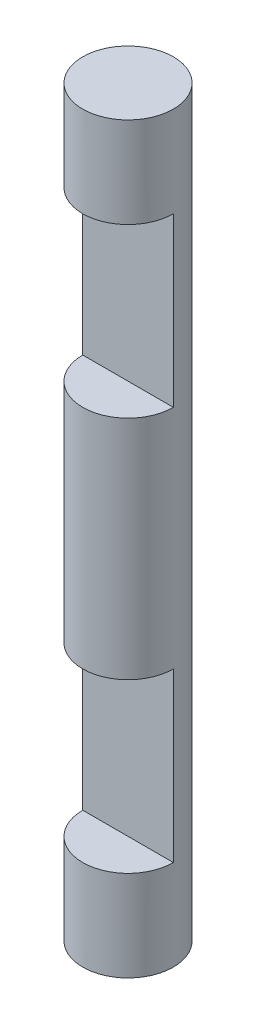
from build123d import *

# Parameters (mm, degrees)
SKETCH1_R           = 13
BOSS_EXTRUDE1_DEPTH = 1
SKETCH16_R          = 13
BOSS_EXTRUDE3_DEPTH = 1
SKETCH19_R          = 1
BOSS_EXTRUDE4_DEPTH = 29.8
SKETCH18_W          = 22
SKETCH18_H          = 22
CUT_EXTRUDE6_DEPTH  = 3.7
SKETCH21_W          = 22
SKETCH21_H          = 22
CUT_EXTRUDE7_DEPTH  = 3.7
SKETCH22_R          = 11
CUT_EXTRUDE8_DEPTH  = 3.7
SKETCH23_R          = 11
CUT_EXTRUDE9_DEPTH  = 3.7
SKETCH24_R          = 19.921792127
CUT_EXTRUDE10_DEPTH = 1
SKETCH25_R          = 36.182885583
CUT_EXTRUDE11_DEPTH = 1
BOSS_EXTRUDE5_START = 2
BOSS_EXTRUDE5_DEPTH = 2
SKETCH27_R          = 1
BOSS_EXTRUDE6_DEPTH = 2
SKETCH28_R          = 9.676669919
CUT_EXTRUDE12_DEPTH = 17.4


with BuildPart() as part:
    # Sketch1 → Boss-Extrude1 (new body)
    with BuildSketch(Plane(origin=(0, 0, 0), x_dir=(1, 0, 0), z_dir=(0, 1, 0))):
        with Locations(Location((0, 0, 0), (0, 0, 270))):
            Circle(SKETCH1_R)
    extrude(amount=BOSS_EXTRUDE1_DEPTH)



with BuildPart() as body_2:
    # Sketch16 → Boss-Extrude3 (new body)
    with BuildSketch(Plane(origin=(0, 30.8, 0), x_dir=(1, 0, 0), z_dir=(0, 1, 0))):
        with Locations(Location((0, 0, 0), (0, 0, 270))):
            Circle(SKETCH16_R)
    extrude(amount=BOSS_EXTRUDE3_DEPTH)


with BuildPart() as part_1:
    add(part.part)

    add(body_2.part)  # Boss-Extrude4 merges body 2
    # Sketch19 → Boss-Extrude4 (add)
    with BuildSketch(Plane(origin=(0, 1, 0), x_dir=(1, 0, 0), z_dir=(0, 1, 0))):
        with Locations(Location((0, 11, 0), (0, 0, 270))):
            Circle(SKETCH19_R)
    extrude(amount=BOSS_EXTRUDE4_DEPTH)

    # Sketch18 → Cut-Extrude6 (cut)
    with BuildSketch(Plane(origin=(0, 4.7, 0), x_dir=(1, 0, 0), z_dir=(0, 1, 0))):
        Rectangle(SKETCH18_W, SKETCH18_H)
    extrude(amount=-CUT_EXTRUDE6_DEPTH, mode=Mode.SUBTRACT)

    # Sketch21 → Cut-Extrude7 (cut)
    with BuildSketch(Plane(origin=(0, 13.4, 0), x_dir=(1, 0, 0), z_dir=(0, 1, 0))):
        Rectangle(SKETCH21_W, SKETCH21_H)
    extrude(amount=-CUT_EXTRUDE7_DEPTH, mode=Mode.SUBTRACT)

    # Sketch22 → Cut-Extrude8 (cut)
    with BuildSketch(Plane(origin=(0, 22.1, 0), x_dir=(1, 0, 0), z_dir=(0, 1, 0))):
        Circle(SKETCH22_R)
    extrude(amount=-CUT_EXTRUDE8_DEPTH, mode=Mode.SUBTRACT)

    # Sketch23 → Cut-Extrude9 (cut)
    with BuildSketch(Plane(origin=(0, 30.8, 0), x_dir=(1, 0, 0), z_dir=(0, 1, 0))):
        Circle(SKETCH23_R)
    extrude(amount=-CUT_EXTRUDE9_DEPTH, mode=Mode.SUBTRACT)

    # Sketch24 → Cut-Extrude10 (cut)
    with BuildSketch(Plane(origin=(0, 31.8, 0), x_dir=(1, 0, 0), z_dir=(0, 1, 0))):
        Circle(SKETCH24_R)
    extrude(amount=-CUT_EXTRUDE10_DEPTH, mode=Mode.SUBTRACT)

    # Sketch25 → Cut-Extrude11 (cut)
    with BuildSketch(Plane(origin=(0, 1, 0), x_dir=(1, 0, 0), z_dir=(0, 1, 0))):
        Circle(SKETCH25_R)
    extrude(amount=-CUT_EXTRUDE11_DEPTH, mode=Mode.SUBTRACT)

    # Sketch26 → Boss-Extrude5 (add)
    with BuildSketch(Plane(origin=(0, 30.8, 0), x_dir=(1, 0, 0), z_dir=(0, 1, 0)).offset(BOSS_EXTRUDE5_START)):
        with BuildLine():
            ThreePointArc((-0.998966408, 10.954545455), (0, 11), (0.998966408, 10.954545455))
            ThreePointArc((0.998966408, 10.954545455), (0, 12), (-0.998966408, 10.954545455))
        make_face()
        with BuildLine():
            ThreePointArc((0.998966408, 10.954545455), (0.999741569, 10.977266852), (1, 11))
            ThreePointArc((1, 11), (-0.022733148, 11.999741569), (-0.998966408, 10.954545455))
            ThreePointArc((-0.998966408, 10.954545455), (0, 11), (0.998966408, 10.954545455))
        make_face()
        with BuildLine():
            ThreePointArc((0.998966408, 10.954545455), (0, 11), (-0.998966408, 10.954545455))
            ThreePointArc((-0.998966408, 10.954545455), (0, 10), (0.998966408, 10.954545455))
        make_face()
    extrude(amount=-BOSS_EXTRUDE5_DEPTH)

    # Sketch27 → Boss-Extrude6 (add)
    with BuildSketch(Plane.XZ.offset(-1)):
        with Locations(Location((0, -11, 0), (0, 0, 270))):
            Circle(SKETCH27_R)
    extrude(amount=BOSS_EXTRUDE6_DEPTH)

    # Sketch28 → Cut-Extrude12 (cut)
    with BuildSketch(Plane(origin=(0, 32.8, 0), x_dir=(1, 0, 0), z_dir=(0, 1, 0))):
        with Locations((0, 11)):
            Circle(SKETCH28_R)
    extrude(amount=-CUT_EXTRUDE12_DEPTH, mode=Mode.SUBTRACT)


solid = part_1.part
